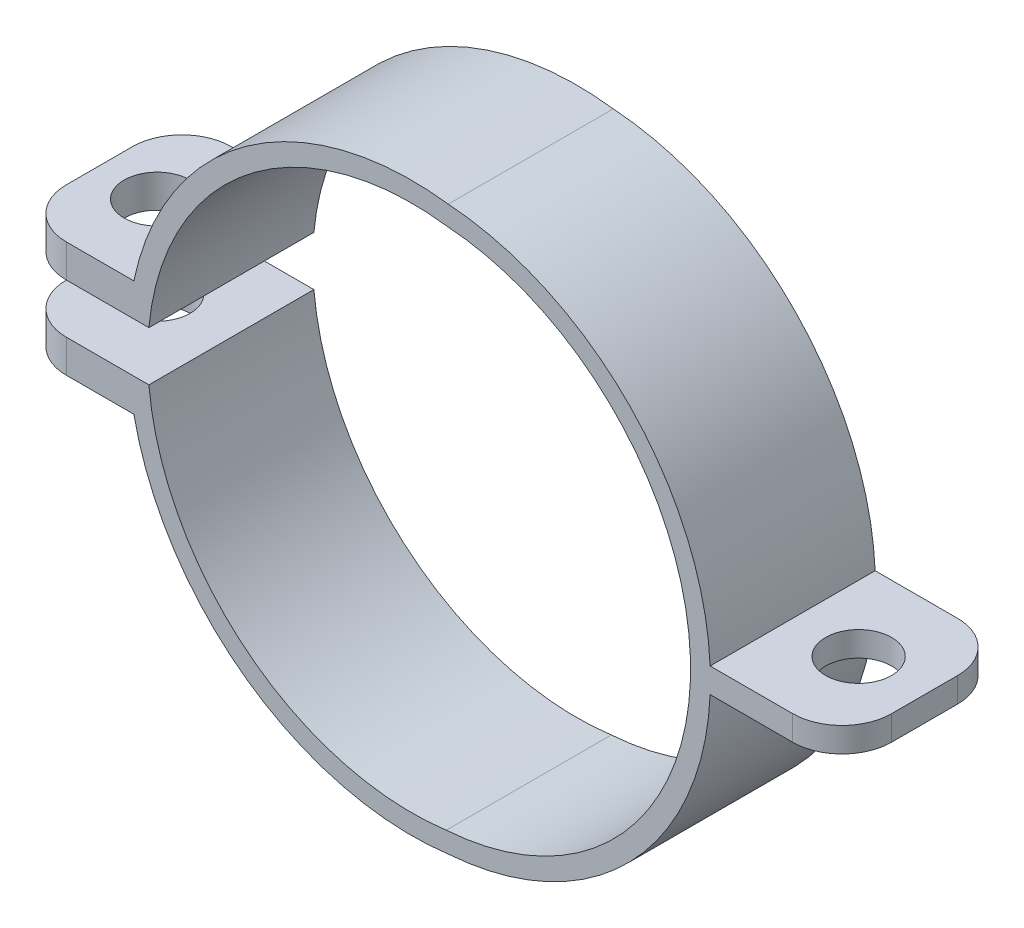
from build123d import *

# Parameters (mm, degrees)
BOSS_EXTRUDE2_DEPTH      = 5
BOSS_EXTRUDE2_DEPTH_BACK = 5
CUT_EXTRUDE1_DEPTH       = 33.786759245
CUT_EXTRUDE1_DEPTH_BACK  = 33.786759245
SKETCH2_R                = 2
BOSS_EXTRUDE3_DEPTH      = 5
BOSS_EXTRUDE3_DEPTH_BACK = 5
SKETCH3_W                = 8
SKETCH3_H                = 1.5
CUT_EXTRUDE2_DEPTH       = 32.24718732
CUT_EXTRUDE2_DEPTH_BACK  = 32.24718732
SKETCH4_R                = 2
FILLET1_R                = 3


with BuildPart() as part:
    # Sketch1 → Boss-Extrude2 (new, two sides: drawn at the far end of the back side and taken through both)
    with BuildSketch(Plane.XY.offset(-BOSS_EXTRUDE2_DEPTH_BACK)):
        with BuildLine():
            Line((-16.929532322, 1.5), (-24.929532322, 1.5))
            Line((-24.929532322, 1.5), (-24.929532322, 3.5))
            Line((-24.929532322, 3.5), (-17.840130641, 3.5))
            ThreePointArc((-17.840130641, 3.5), (-10.970967291, 14.01498524), (1.215, 17.05678091))
            ThreePointArc((1.215, 17.05678091), (17.1, 0), (1.215, -17.05678091))
            ThreePointArc((1.215, -17.05678091), (-10.970967291, -14.01498524), (-17.840130641, -3.5))
            Line((-17.840130641, -3.5), (-24.929532322, -3.5))
            Line((-24.929532322, -3.5), (-24.929532322, -1.5))
            Line((-24.929532322, -1.5), (-16.929532322, -1.5))
            ThreePointArc((-16.929532322, -1.5), (-10.970813778, -12.51330782), (1.095, -15.862249998))
            ThreePointArc((1.095, -15.862249998), (15.9, 0), (1.095, 15.862249998))
            ThreePointArc((1.095, 15.862249998), (-10.970813778, 12.51330782), (-16.929532322, 1.5))
        make_face()
    extrude(amount=BOSS_EXTRUDE2_DEPTH + BOSS_EXTRUDE2_DEPTH_BACK)

    # Sketch2 → Cut-Extrude1 (cut, two sides: drawn at the far end of the back side and taken through both)
    with BuildSketch(Plane(origin=(0, 3.5, 0), x_dir=(1, 0, 0), z_dir=(0, 1, 0)).offset(-CUT_EXTRUDE1_DEPTH_BACK)):
        with Locations((-21.429532322, 0)):
            Circle(SKETCH2_R)
    extrude(amount=CUT_EXTRUDE1_DEPTH + CUT_EXTRUDE1_DEPTH_BACK, mode=Mode.SUBTRACT)

    # Sketch3 → Boss-Extrude3 (add, two sides: drawn at the far end of the back side and taken through both)
    with BuildSketch(Plane.XY.offset(-BOSS_EXTRUDE3_DEPTH_BACK)):
        with Locations((21.083544714, 0)):
            Rectangle(SKETCH3_W, SKETCH3_H)
    extrude(amount=BOSS_EXTRUDE3_DEPTH + BOSS_EXTRUDE3_DEPTH_BACK)

    # Sketch4 → Cut-Extrude2 (cut, two sides: drawn at the far end of the back side and taken through both)
    with BuildSketch(Plane(origin=(0, 0.75, 0), x_dir=(1, 0, 0), z_dir=(0, 1, 0)).offset(-CUT_EXTRUDE2_DEPTH_BACK)):
        with Locations((21.083544714, 0)):
            Circle(SKETCH4_R)
    extrude(amount=CUT_EXTRUDE2_DEPTH + CUT_EXTRUDE2_DEPTH_BACK, mode=Mode.SUBTRACT)

    # Fillet1
    fillet1_edges = [part.edges().sort_by_distance(p)[0] for p in [
        (-24.929532322, -2.5, -5),
        (-24.929532322, 2.5, -5),
        (-24.929532322, -2.5, 5),
        (-24.929532322, 2.5, 5),
        (25.083544714, 0, 5),
        (25.083544714, 0, -5),
    ]]
    fillet(fillet1_edges, radius=FILLET1_R)


solid = part.part
